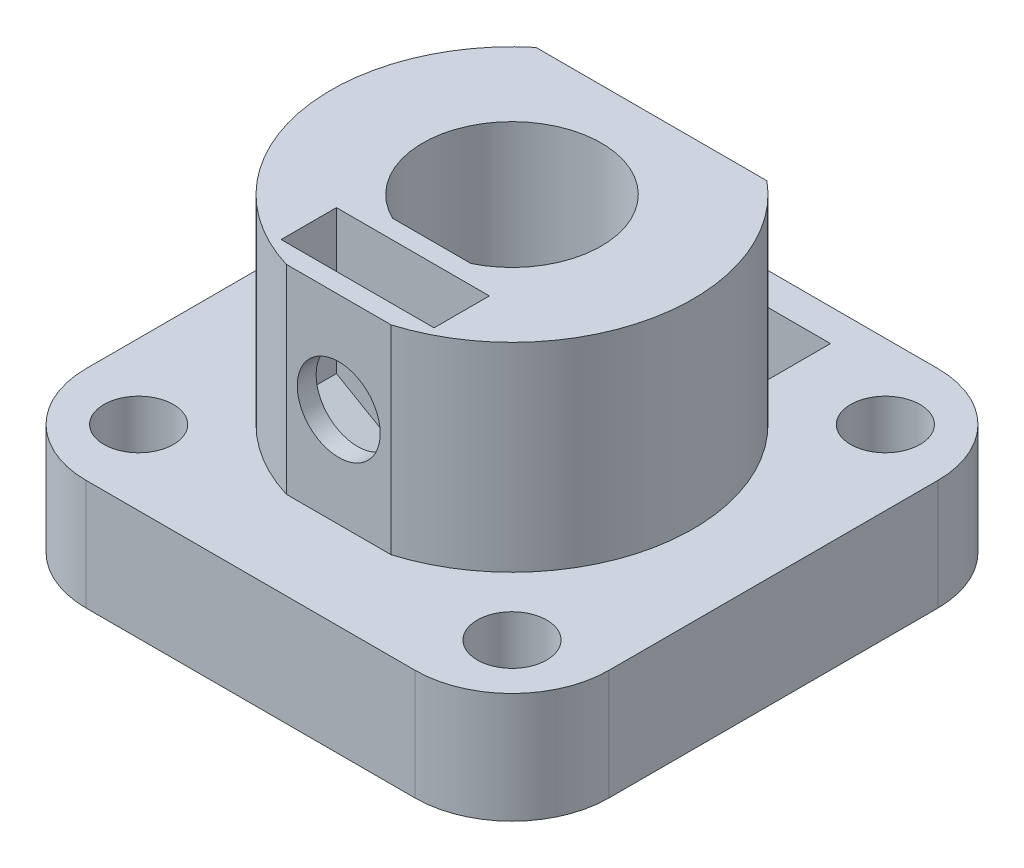
from build123d import *

# Parameters (mm, degrees)
SKETCH1_W               = 18.9
SKETCH1_H               = 18.9
SKETCH1_R               = 1.255147878
BOSS_EXTRUDE1_DEPTH     = 4
FILLET1_R               = 3.5
BOSS_EXTRUDE2_DEPTH     = 7.2
SKETCH3_R               = 1.5
CUT_EXTRUDE1_DEPTH      = 7.2
CUT_EXTRUDE2_DEPTH      = 1
CUT_EXTRUDE2_DEPTH_BACK = 1
CUT_EXTRUDE3_START      = -4
CUT_EXTRUDE3_DEPTH      = 4
SKETCH6_W               = 8.351743046
SKETCH6_H               = 2
CUT_EXTRUDE4_DEPTH      = 7.2
SKETCH7_W               = 6.001336377
SKETCH7_H               = 3.250686631
CUT_EXTRUDE5_DEPTH      = 4


with BuildPart() as part:
    # Sketch1 → Boss-Extrude1 (new body)
    with BuildSketch(Plane(origin=(0, 0, 0), x_dir=(1, 0, 0), z_dir=(0, 1, 0))):
        Rectangle(SKETCH1_W, SKETCH1_H)
        with Locations(Location((-6.75, 6.75, 0), (0, 0, 270))):
            Circle(SKETCH1_R, mode=Mode.SUBTRACT)
        with Locations(Location((6.75, 6.75, 0), (0, 0, 270))):
            Circle(SKETCH1_R, mode=Mode.SUBTRACT)
        with Locations(Location((6.75, -6.75, 0), (0, 0, 270))):
            Circle(SKETCH1_R, mode=Mode.SUBTRACT)
        with Locations(Location((-6.75, -6.75, 0), (0, 0, 270))):
            Circle(SKETCH1_R, mode=Mode.SUBTRACT)
    extrude(amount=BOSS_EXTRUDE1_DEPTH)

    # Fillet1
    fillet1_edges = [part.edges().sort_by_distance(p)[0] for p in [
        (-9.45, 2, 9.45),
        (-9.45, 2, -9.45),
        (9.45, 2, -9.45),
        (9.45, 2, 9.45),
    ]]
    fillet(fillet1_edges, radius=FILLET1_R)

    # Sketch2 → Boss-Extrude2 (add)
    with BuildSketch(Plane(origin=(0, 4, 0), x_dir=(1, 0, 0), z_dir=(0, 1, 0))):
        with BuildLine():
            Line((1.89565101, -6.265449543), (-1.89565101, -6.265449543))
            ThreePointArc((-1.89565101, -6.265449543), (0, 6.545941546), (1.89565101, -6.265449543))
        make_face()
        with BuildLine():
            Line((1.42, -2.901120473), (-1.42, -2.901120473))
            ThreePointArc((-1.42, -2.901120473), (0, 3.23), (1.42, -2.901120473))
        make_face(mode=Mode.SUBTRACT)
    extrude(amount=BOSS_EXTRUDE2_DEPTH)

    # Sketch3 → Cut-Extrude1 (cut)
    with BuildSketch(Plane.XY.offset(6.265449543)):
        with Locations((0, 7.6)):
            Circle(SKETCH3_R)
    extrude(amount=-CUT_EXTRUDE1_DEPTH, mode=Mode.SUBTRACT)

    # Sketch4 → Cut-Extrude2 (cut, two sides: drawn at the far end of the back side and taken through both)
    with BuildSketch(Plane(origin=(0, 0, 4.583285008), x_dir=(-1, 0, 0), z_dir=(0, 0, -1)).offset(-CUT_EXTRUDE2_DEPTH_BACK)):
        Polygon((-2.765, 9.196373494), (-2.765, 6.003626506), (0, 4.407253011), (2.765, 6.003626506), (2.765, 9.196373494), (0, 10.792746989), align=None)
        Polygon((2.765, 11.723212655), (-2.765, 11.723212655), (-2.765, 9.196373494), (0, 10.792746989), (2.765, 9.196373494), align=None)
    extrude(amount=CUT_EXTRUDE2_DEPTH + CUT_EXTRUDE2_DEPTH_BACK, mode=Mode.SUBTRACT)

    # Sketch5 → Cut-Extrude3 (cut)
    with BuildSketch(Plane(origin=(0, 4, 0), x_dir=(1, 0, 0), z_dir=(0, 1, 0)).offset(CUT_EXTRUDE3_START)):
        with BuildLine():
            Line((-1.42, -2.901120473), (1.42, -2.901120473))
            ThreePointArc((1.42, -2.901120473), (0, 3.23), (-1.42, -2.901120473))
        make_face()
    extrude(amount=CUT_EXTRUDE3_DEPTH, mode=Mode.SUBTRACT)

    # Sketch6 → Cut-Extrude4 (cut)
    with BuildSketch(Plane(origin=(0, 11.2, 0), x_dir=(1, 0, 0), z_dir=(0, 1, 0))):
        with Locations((0, 6.040976864)):
            Rectangle(SKETCH6_W, SKETCH6_H)
    extrude(amount=-CUT_EXTRUDE4_DEPTH, mode=Mode.SUBTRACT)

    # Sketch7 → Cut-Extrude5 (cut)
    with BuildSketch(Plane(origin=(0, 4, 0), x_dir=(1, 0, 0), z_dir=(0, 1, 0))):
        with Locations((0.224673796, 6.666320179)):
            Rectangle(SKETCH7_W, SKETCH7_H)
    extrude(amount=-CUT_EXTRUDE5_DEPTH, mode=Mode.SUBTRACT)


solid = part.part
